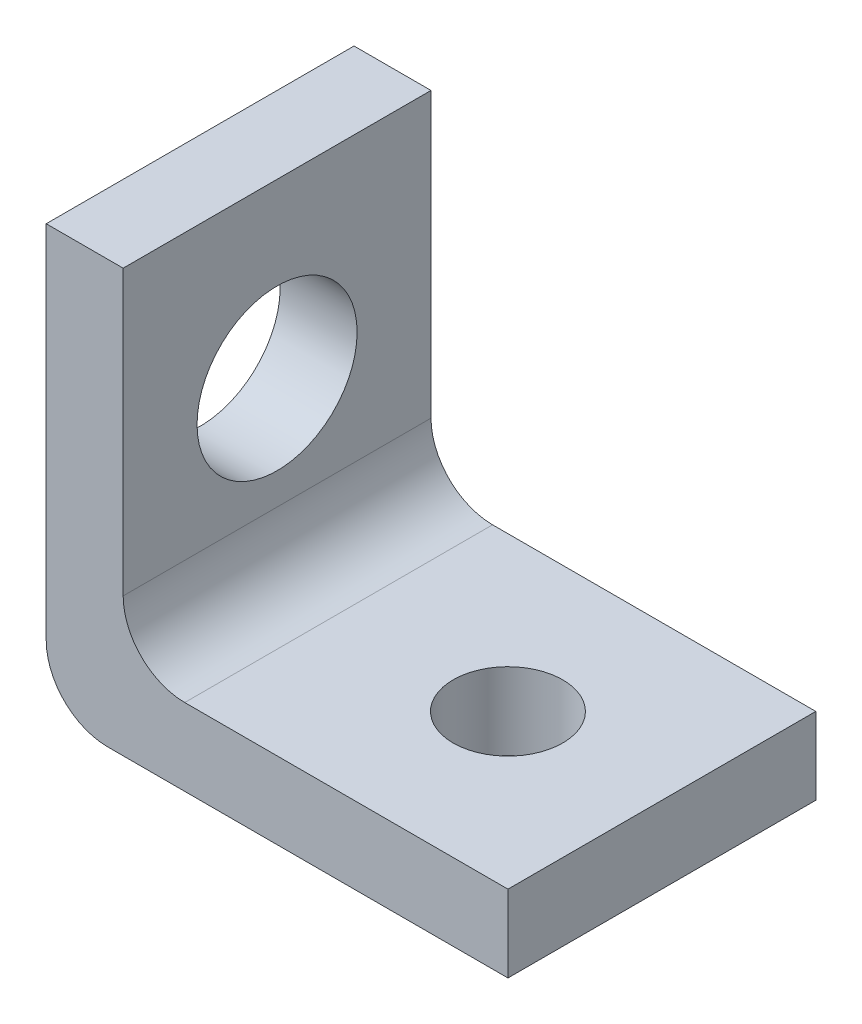
from build123d import *

# Parameters (mm, degrees)
BOSS_EXTRUDE1_DEPTH       = 6.35
F_4_CLEARANCE_HOLE1_D     = 3.302
F_4_CLEARANCE_HOLE1_DEPTH = 57.15
F_4_CLEARANCE_HOLE1_TIP   = 0.992020882
F_4_40_TAPPED_HOLE1_D     = 2.2606


with BuildPart() as part:
    # Sketch1 → Boss-Extrude1 (new body)
    with BuildSketch(Plane.XY):
        with BuildLine():
            Line((0, 1.27), (0, 7.1247))
            Line((0, 7.1247), (-1.5875, 7.1247))
            Line((-1.5875, 7.1247), (-1.5875, -0.3175))
            ThreePointArc((-1.5875, -0.3175), (-1.215525612, -1.215525612), (-0.3175, -1.5875))
            Line((-0.3175, -1.5875), (7.9375, -1.5875))
            Line((7.9375, -1.5875), (7.9375, 0))
            Line((7.9375, 0), (1.27, 0))
            ThreePointArc((1.27, 0), (0.371974388, 0.371974388), (0, 1.27))
        make_face()
    extrude(amount=BOSS_EXTRUDE1_DEPTH)

    # #4 Clearance Hole1
    with Locations(Plane(origin=(0, 0, 0), x_dir=(0, 0, -1), z_dir=(1, 0, 0))):
        with Locations((-3.175, 3.5687)):
            Hole(F_4_CLEARANCE_HOLE1_D / 2, depth=F_4_CLEARANCE_HOLE1_DEPTH)
            with Locations((0, 0, -(F_4_CLEARANCE_HOLE1_DEPTH + F_4_CLEARANCE_HOLE1_TIP / 2))):  # 118° drill point
                Cone(0, F_4_CLEARANCE_HOLE1_D / 2, F_4_CLEARANCE_HOLE1_TIP, mode=Mode.SUBTRACT)

    # #4-40 Tapped Hole1 (through all)
    with Locations(Plane(origin=(0, 0, 0), x_dir=(1, 0, 0), z_dir=(0, 1, 0))):
        with Locations((4.7625, -3.175)):
            Hole(F_4_40_TAPPED_HOLE1_D / 2)


solid = part.part
